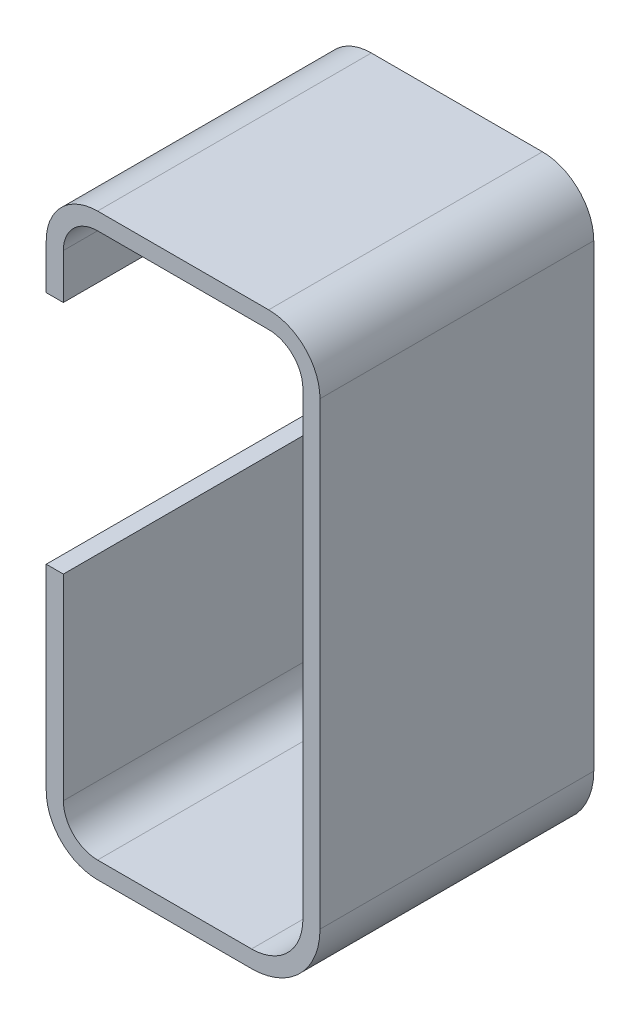
from build123d import *

# Parameters (mm, degrees)
BOSS_EXTRUDE1_DEPTH      = 8
BOSS_EXTRUDE1_DEPTH_BACK = 8


with BuildPart() as part:
    # Sketch1 → Boss-Extrude1 (new, two sides: drawn at the far end of the back side and taken through both)
    with BuildSketch(Plane.XY.offset(-BOSS_EXTRUDE1_DEPTH_BACK)):
        with BuildLine():
            Line((-23.041785381, -271.526308081), (-23.041785381, -283))
            ThreePointArc((-23.041785381, -283), (-22.163105725, -285.121320344), (-20.041785381, -286))
            Line((-20.041785381, -286), (-11.041785381, -286))
            ThreePointArc((-11.041785381, -286), (-8.213358256, -284.828427125), (-7.041785381, -282))
            Line((-7.041785381, -282), (-7.041785381, -255.150929215))
            ThreePointArc((-7.041785381, -255.150929215), (-7.920465038, -253.029608872), (-10.041785381, -252.150929215))
            Line((-10.041785381, -252.150929215), (-20.041785381, -252.150929215))
            ThreePointArc((-20.041785381, -252.150929215), (-22.163105725, -253.029608872), (-23.041785381, -255.150929215))
            Line((-23.041785381, -255.150929215), (-23.041785381, -257.783091126))
            Line((-23.041785381, -257.783091126), (-22.041785381, -257.783091126))
            Line((-22.041785381, -257.783091126), (-22.041785381, -255.150929215))
            ThreePointArc((-22.041785381, -255.150929215), (-21.455998944, -253.736715653), (-20.041785381, -253.150929215))
            Line((-20.041785381, -253.150929215), (-10.041785381, -253.150929215))
            ThreePointArc((-10.041785381, -253.150929215), (-8.627571819, -253.736715653), (-8.041785381, -255.150929215))
            Line((-8.041785381, -255.150929215), (-8.041785381, -282))
            ThreePointArc((-8.041785381, -282), (-8.920465038, -284.121320344), (-11.041785381, -285))
            Line((-11.041785381, -285), (-20.041785381, -285))
            ThreePointArc((-20.041785381, -285), (-21.455998944, -284.414213562), (-22.041785381, -283))
            Line((-22.041785381, -283), (-22.041785381, -271.526308081))
            Line((-22.041785381, -271.526308081), (-23.041785381, -271.526308081))
        make_face()
    extrude(amount=BOSS_EXTRUDE1_DEPTH + BOSS_EXTRUDE1_DEPTH_BACK)


solid = part.part
